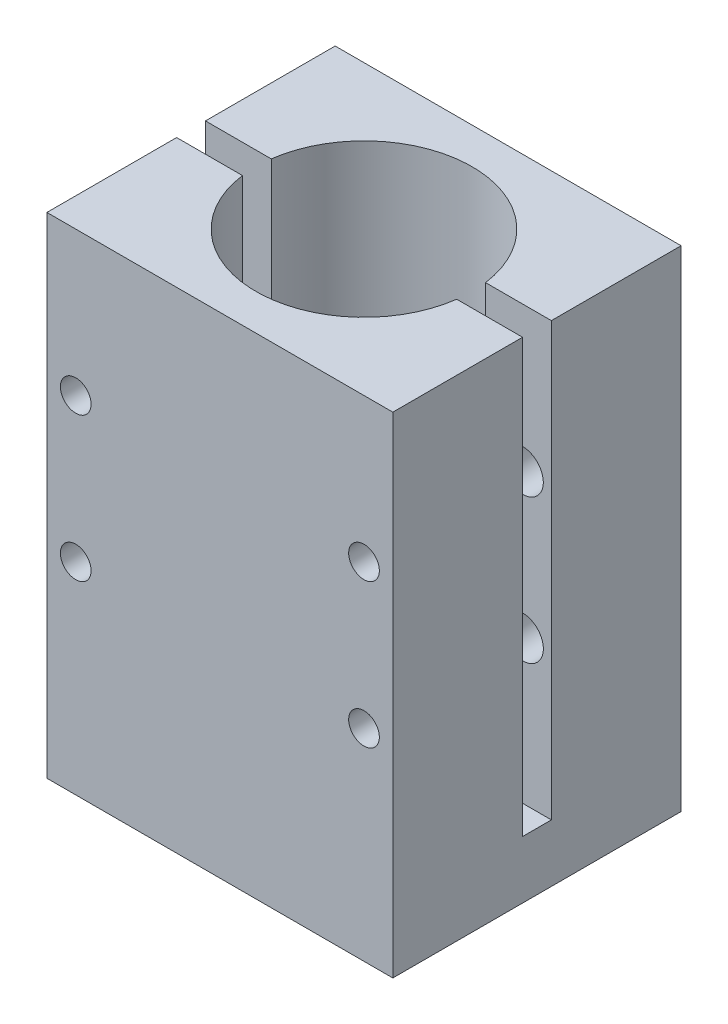
from build123d import *

# Parameters (mm, degrees)
SKETCH1_W                       = 55.88
SKETCH1_H                       = 25.4
EXTRUDE1_DEPTH                  = 101.6
SKETCH4_R                       = 9.525
CUT_EXTRUDE2_DEPTH              = 58.42
SKETCH7_W                       = 25.4
SKETCH7_H                       = 101.6
CUT_EXTRUDE5_DEPTH              = 12.7
SKETCH8_W                       = 25.4
SKETCH8_H                       = 101.6
CUT_EXTRUDE6_DEPTH              = 12.7
SKETCH15_W                      = 5.800046345
SKETCH15_H                      = 2.54
CUT_EXTRUDE10_DEPTH             = 58.42
F_27_0_144_DIAMETER_HOLE1_D     = 3.6576
F_27_0_144_DIAMETER_HOLE1_DEPTH = 13.97
F_27_0_144_DIAMETER_HOLE2_D     = 3.6576
F_27_0_144_DIAMETER_HOLE2_DEPTH = 13.97
F_6_32_TAPPED_HOLE1_D           = 2.7051
F_6_32_TAPPED_HOLE1_DEPTH       = 11.43
F_6_32_TAPPED_HOLE1_TIP         = 0.81269403
F_6_32_TAPPED_HOLE2_D           = 2.7051
F_6_32_TAPPED_HOLE2_DEPTH       = 11.43
F_6_32_TAPPED_HOLE2_TIP         = 0.81269403
SKETCH37_W                      = 25.4
SKETCH37_H                      = 38.1
CUT_EXTRUDE11_DEPTH             = 114.279443855
F_8_32_TAPPED_HOLE3_D           = 3.4544
CIRPATTERN2_COUNT               = 2
SKETCH44_W                      = 30.48
SKETCH44_H                      = 20.32
CUT_EXTRUDE12_DEPTH             = 107.02028155
CIRPATTERN3_COUNT               = 2
F_6_32_TAPPED_HOLE3_D           = 2.7051
F_6_32_TAPPED_HOLE3_DEPTH       = 13.97
F_6_32_TAPPED_HOLE4_D           = 2.7051
F_6_32_TAPPED_HOLE4_DEPTH       = 13.97
F_27_0_144_DIAMETER_HOLE3_D     = 3.6576
F_27_0_144_DIAMETER_HOLE3_DEPTH = 13.97
F_27_0_144_DIAMETER_HOLE4_D     = 3.6576
F_27_0_144_DIAMETER_HOLE4_DEPTH = 13.97


with BuildPart() as part:
    # Sketch1 → Extrude1 (new body)
    with BuildSketch(Plane(origin=(0, 0, 0), x_dir=(1, 0, 0), z_dir=(0, 1, 0))):
        with Locations((-1.27, -12.7)):
            Rectangle(SKETCH1_W, SKETCH1_H)
    extrude(amount=EXTRUDE1_DEPTH)

    # Sketch4 → Cut-Extrude2 (cut)
    with BuildSketch(Plane(origin=(0, 101.6, 0), x_dir=(-1, 0, 0), z_dir=(0, 1, 0))):
        with Locations(Location((1.27, 12.7, 0), (0, 0, 90))):
            Circle(SKETCH4_R)
    extrude(amount=-CUT_EXTRUDE2_DEPTH, mode=Mode.SUBTRACT)

    # Sketch7 → Cut-Extrude5 (cut)
    with BuildSketch(Plane(origin=(26.67, 0, 0), x_dir=(0, 0, -1), z_dir=(1, 0, 0))):
        with Locations((-12.7, 50.8)):
            Rectangle(SKETCH7_W, SKETCH7_H)
    extrude(amount=-CUT_EXTRUDE5_DEPTH, mode=Mode.SUBTRACT)

    # Sketch8 → Cut-Extrude6 (cut)
    with BuildSketch(Plane.ZY.offset(29.21)):
        with Locations((12.7, 50.8)):
            Rectangle(SKETCH8_W, SKETCH8_H)
    extrude(amount=-CUT_EXTRUDE6_DEPTH, mode=Mode.SUBTRACT)

    # Sketch15 → Cut-Extrude10 (cut)
    with BuildSketch(Plane(origin=(0, 101.6, 0), x_dir=(-1, 0, 0), z_dir=(0, 1, 0))):
        with Locations((-11.069976827, 12.7)):
            Rectangle(SKETCH15_W, SKETCH15_H)
    cut_extrude10 = extrude(amount=-CUT_EXTRUDE10_DEPTH, mode=Mode.SUBTRACT)

    # #27 (0.144) Diameter Hole1
    with Locations(Plane(origin=(11.43, 68.58, 0), x_dir=(-1, 0, 0), z_dir=(0, 0, -1))):
        with Locations((0, 0)):
            Hole(F_27_0_144_DIAMETER_HOLE1_D / 2, depth=F_27_0_144_DIAMETER_HOLE1_DEPTH)

    # #27 (0.144) Diameter Hole2
    with Locations(Plane(origin=(11.434321399, 55.88, 0), x_dir=(-1, 0, 0), z_dir=(0, 0, -1))):
        with Locations((0, 0)):
            Hole(F_27_0_144_DIAMETER_HOLE2_D / 2, depth=F_27_0_144_DIAMETER_HOLE2_DEPTH)

    # #6-32 Tapped Hole1
    with Locations(Plane(origin=(11.43, 68.58, 25.4), x_dir=(1, 0, 0), z_dir=(0, 0, 1))):
        with Locations((0, 0)):
            Hole(F_6_32_TAPPED_HOLE1_D / 2, depth=F_6_32_TAPPED_HOLE1_DEPTH)
            with Locations((0, 0, -(F_6_32_TAPPED_HOLE1_DEPTH + F_6_32_TAPPED_HOLE1_TIP / 2))):  # 118° drill point
                Cone(0, F_6_32_TAPPED_HOLE1_D / 2, F_6_32_TAPPED_HOLE1_TIP, mode=Mode.SUBTRACT)

    # #6-32 Tapped Hole2
    with Locations(Plane(origin=(11.43, 55.88, 25.4), x_dir=(1, 0, 0), z_dir=(0, 0, 1))):
        with Locations((0, 0)):
            Hole(F_6_32_TAPPED_HOLE2_D / 2, depth=F_6_32_TAPPED_HOLE2_DEPTH)
            with Locations((0, 0, -(F_6_32_TAPPED_HOLE2_DEPTH + F_6_32_TAPPED_HOLE2_TIP / 2))):  # 118° drill point
                Cone(0, F_6_32_TAPPED_HOLE2_D / 2, F_6_32_TAPPED_HOLE2_TIP, mode=Mode.SUBTRACT)

    # Sketch37 → Cut-Extrude11 (cut, through all)
    with BuildSketch(Plane.ZY.offset(29.21)):
        with Locations((12.7, 19.05)):
            Rectangle(SKETCH37_W, SKETCH37_H)
    extrude(amount=-CUT_EXTRUDE11_DEPTH, mode=Mode.SUBTRACT)

    # #8-32 Tapped Hole3 (through all)
    with Locations(Plane(origin=(-1.27, 38.1, 19.05), x_dir=(0, 0, -1), z_dir=(0, -1, 0))):
        with Locations((0, 0)):
            f_8_32_tapped_hole3 = Hole(F_8_32_TAPPED_HOLE3_D / 2)

    # CirPattern2: #8-32 Tapped Hole3 ×2 about axis
    cirpattern2_axis = Axis((-1.27, 0, 12.7), (0, 1, 0))
    for i in range(1, CIRPATTERN2_COUNT):
        add(f_8_32_tapped_hole3.rotate(cirpattern2_axis, i * 360 / CIRPATTERN2_COUNT), mode=Mode.SUBTRACT)

    # Sketch44 → Cut-Extrude12 (cut, through all)
    with BuildSketch(Plane(origin=(0, 0, 0), x_dir=(-1, 0, 0), z_dir=(0, 0, -1))):
        with Locations((1.27, 91.44)):
            Rectangle(SKETCH44_W, SKETCH44_H)
    extrude(amount=-CUT_EXTRUDE12_DEPTH, mode=Mode.SUBTRACT)

    # CirPattern3: Cut-Extrude10 ×2 about axis
    cirpattern3_axis = Axis((-1.27, 87.197587188, 12.7), (0, 1, 0))
    for i in range(1, CIRPATTERN3_COUNT):
        add(cut_extrude10.rotate(cirpattern3_axis, i * 360 / CIRPATTERN3_COUNT), mode=Mode.SUBTRACT)

    # #6-32 Tapped Hole3
    with Locations(Plane(origin=(-13.97, 68.58, 25.4), x_dir=(1, 0, 0), z_dir=(0, 0, 1))):
        with Locations((0, 0)):
            Hole(F_6_32_TAPPED_HOLE3_D / 2, depth=F_6_32_TAPPED_HOLE3_DEPTH)

    # #6-32 Tapped Hole4
    with Locations(Plane(origin=(-13.97, 55.88, 25.4), x_dir=(1, 0, 0), z_dir=(0, 0, 1))):
        with Locations((0, 0)):
            Hole(F_6_32_TAPPED_HOLE4_D / 2, depth=F_6_32_TAPPED_HOLE4_DEPTH)

    # #27 (0.144) Diameter Hole3
    with Locations(Plane(origin=(-13.97, 68.58, 0), x_dir=(-1, 0, 0), z_dir=(0, 0, -1))):
        with Locations((0, 0)):
            Hole(F_27_0_144_DIAMETER_HOLE3_D / 2, depth=F_27_0_144_DIAMETER_HOLE3_DEPTH)

    # #27 (0.144) Diameter Hole4
    with Locations(Plane(origin=(-13.97, 55.88, 0), x_dir=(-1, 0, 0), z_dir=(0, 0, -1))):
        with Locations((0, 0)):
            Hole(F_27_0_144_DIAMETER_HOLE4_D / 2, depth=F_27_0_144_DIAMETER_HOLE4_DEPTH)


solid = part.part
